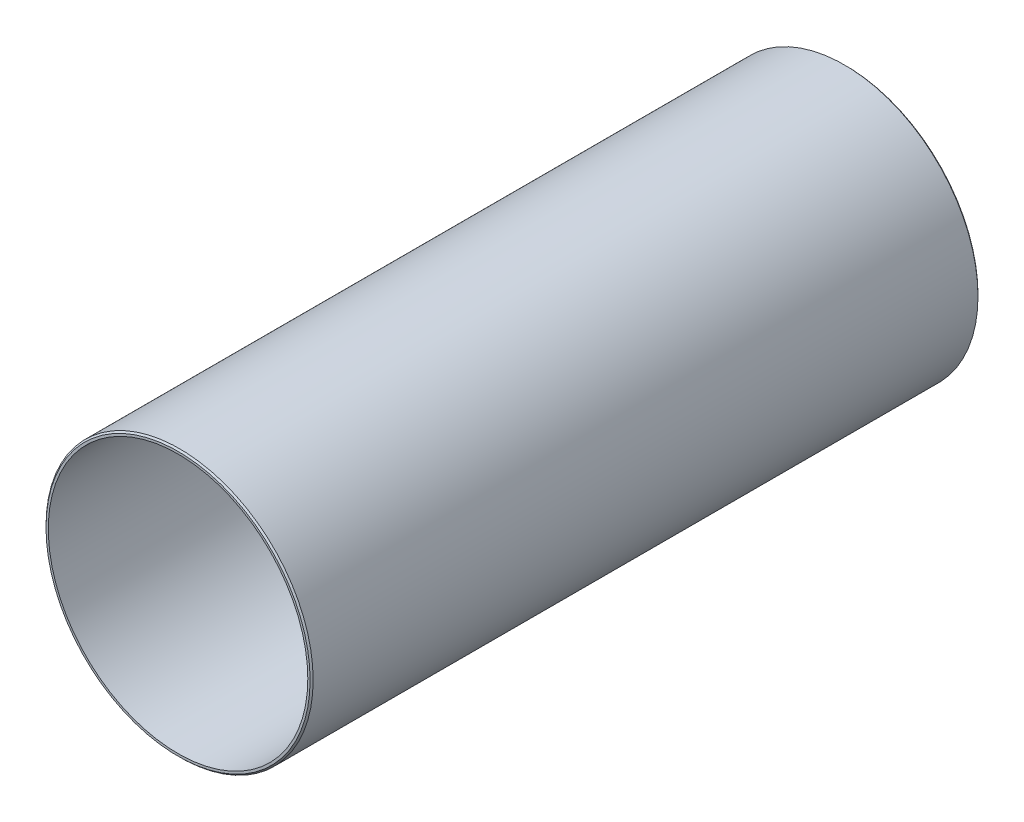
from build123d import *

# Parameters (mm, degrees)
SKETCH1_R           = 17.5
SKETCH1_R_2         = 17
BOSS_EXTRUDE1_DEPTH = 87.5
CHAMFER1_SIZE       = 0.2


with BuildPart() as part:
    # Sketch1 → Boss-Extrude1 (new body)
    with BuildSketch(Plane.XY):
        Circle(SKETCH1_R)
        Circle(SKETCH1_R_2, mode=Mode.SUBTRACT)
    extrude(amount=-BOSS_EXTRUDE1_DEPTH)

    # Chamfer1
    chamfer1_edges = [part.edges().sort_by_distance(p)[0] for p in [
        (-17.5, 0, 0),
        (-17.5, 0, -87.5),
    ]]
    chamfer(chamfer1_edges, length=CHAMFER1_SIZE)


solid = part.part
